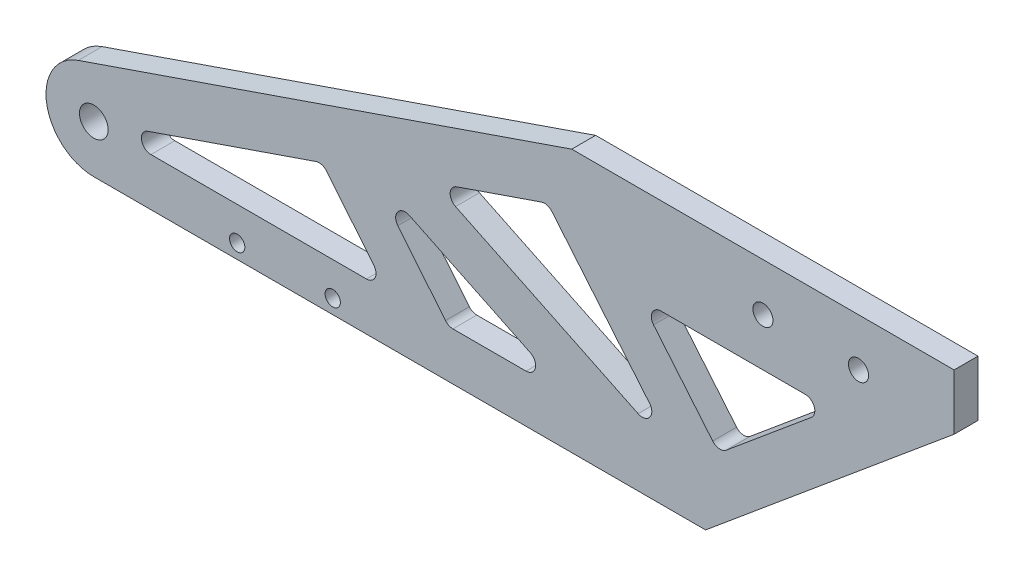
from build123d import *

# Parameters (mm, degrees)
EXTRUDE_1_DEPTH         = 5
SKETCH_2_R              = 3
CUT_EXTRUDE_1_DEPTH     = 198.863589374
CUT_EXTRUDE_2_DEPTH     = 198.863589374
HOLE_WIZARD_3_2_3_2_1_D = 3.2
HOLE_WIZARD_4_2_4_2_1_D = 4.2
CUT_EXTRUDE_3_DEPTH     = 198.863589374


with BuildPart() as part:
    # 草图1 → 凸台-拉伸1 (new body)
    with BuildSketch(Plane.XY):
        with BuildLine():
            Line((0, 0), (0, 55))
            Line((0, 55), (-80, 55))
            Line((-80, 55), (-183.254947339, 19.455438531))
            ThreePointArc((-183.254947339, 19.455438531), (-189.862920088, 8.349906868), (-180, 0))
            Line((-180, 0), (0, 0))
        make_face()
    extrude(amount=EXTRUDE_1_DEPTH)

    # 草图2 → 切除-拉伸1 (cut, through all)
    with BuildSketch(Plane.XY.offset(5)):
        with Locations((-180, 10)):
            Circle(SKETCH_2_R)
    extrude(amount=-CUT_EXTRUDE_1_DEPTH, mode=Mode.SUBTRACT)

    # 草图3 → 切除-拉伸2 (cut, through all)
    with BuildSketch(Plane.XY.offset(5)):
        with BuildLine():
            Line((-113.975045622, 26.000798899), (-88.692623676, 13.801264258))
            ThreePointArc((-88.692623676, 13.801264258), (-87.612105141, 11.554202129), (-89.561788258, 10))
            Line((-89.561788258, 10), (-104.866847196, 10))
            ThreePointArc((-104.866847196, 10), (-105.72348841, 10.192746329), (-106.415015174, 10.733834169))
            Line((-106.415015174, 10.733834169), (-116.392378182, 22.93336881))
            ThreePointArc((-116.392378182, 22.93336881), (-116.415051775, 25.437459016), (-113.975045622, 26.000798899))
        make_face()
        with BuildLine():
            Line((-168.696609563, 13.891087706), (-133.510036225, 26.003740428))
            ThreePointArc((-133.510036225, 26.003740428), (-132.31236206, 26.036486353), (-131.310878779, 25.378818552))
            Line((-131.310878779, 25.378818552), (-121.40457196, 13.266165831))
            ThreePointArc((-121.40457196, 13.266165831), (-121.145486268, 11.143358786), (-122.952739938, 10))
            Line((-122.952739938, 10), (-168.045620095, 10))
            ThreePointArc((-168.045620095, 10), (-170.018204112, 11.669981374), (-168.696609563, 13.891087706))
        make_face()
        with BuildLine():
            Line((-10, 30.729916775), (-10, 12))
            ThreePointArc((-10, 12), (-10.585786438, 10.585786438), (-12, 10))
            Line((-12, 10), (-34.47590013, 10))
            ThreePointArc((-34.47590013, 10), (-36.356443285, 11.319149472), (-35.756268929, 13.536442559))
            Line((-35.756268929, 13.536442559), (-13.280368799, 32.266359334))
            ThreePointArc((-13.280368799, 32.266359334), (-11.151689208, 32.541095617), (-10, 30.729916775))
        make_face()
        with BuildLine():
            Line((-61.350416127, 35), (-31.144599222, 35))
            ThreePointArc((-31.144599222, 35), (-29.264056067, 33.680850528), (-29.864230423, 31.463557441))
            Line((-29.864230423, 31.463557441), (-47.69061417, 16.608237652))
            ThreePointArc((-47.69061417, 16.608237652), (-49.152054461, 16.152893798), (-50.507425528, 16.864311412))
            Line((-50.507425528, 16.864311412), (-62.886858686, 31.719631201))
            ThreePointArc((-62.886858686, 31.719631201), (-63.161594969, 33.848310792), (-61.350416127, 35))
        make_face()
        with BuildLine():
            Line((-84.16091357, 41.62799771), (-63.717267008, 17.095621836))
            ThreePointArc((-63.717267008, 17.095621836), (-63.677184734, 14.584574586), (-66.12287415, 14.013988778))
            Line((-66.12287415, 14.013988778), (-104.307462185, 32.43920949))
            ThreePointArc((-104.307462185, 32.43920949), (-105.434815281, 34.358444754), (-104.08928707, 36.131561455))
            Line((-104.08928707, 36.131561455), (-86.348345597, 42.238716617))
            ThreePointArc((-86.348345597, 42.238716617), (-85.15953535, 42.273959311), (-84.16091357, 41.62799771))
        make_face()
    extrude(amount=-CUT_EXTRUDE_2_DEPTH, mode=Mode.SUBTRACT)

    # Ø3.2 (3.2) 直径孔1 (through all)
    with Locations(Plane(origin=(-150, 3, 5), x_dir=(1, 0, 0), z_dir=(0, 0, 1))):
        with Locations((0, 0), (20, 0)):
            Hole(HOLE_WIZARD_3_2_3_2_1_D / 2)

    # Ø4.2 (4.2) 直径孔1 (through all)
    with Locations(Plane(origin=(-40, 45, 5), x_dir=(1, 0, 0), z_dir=(0, 0, 1))):
        with Locations((0, 0), (20, 0)):
            Hole(HOLE_WIZARD_4_2_4_2_1_D / 2)

    # 草图8 → 切除-拉伸3 (cut, through all)
    with BuildSketch(Plane.XY.offset(5)):
        Polygon((0, 0), (0, 43.333333333), (-52, 0), align=None)
    extrude(amount=-CUT_EXTRUDE_3_DEPTH, mode=Mode.SUBTRACT)


solid = part.part
